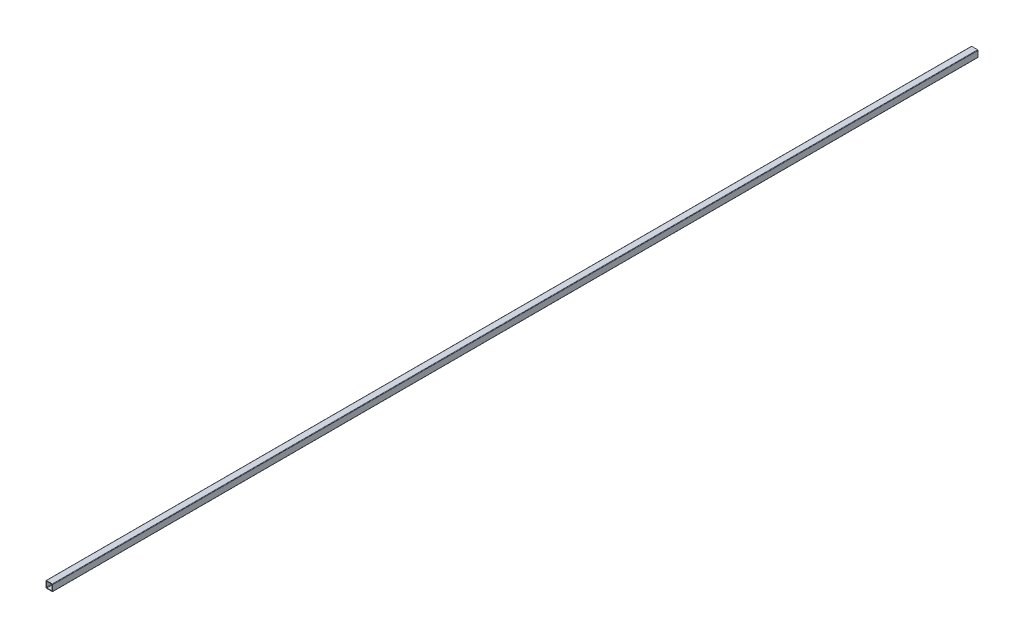
from build123d import *

# Parameters (mm, degrees)
BOSS_EXTRUDE1_DEPTH = 5243.80000006


with BuildPart() as part:
    # Sketch1 → Boss-Extrude1 (new body)
    with BuildSketch(Plane.XY):
        with BuildLine():
            Line((2.54, 0), (35.56, 0))
            ThreePointArc((35.56, 0), (37.356051224, -0.743948776), (38.1, -2.54))
            Line((38.1, -2.54), (38.1, -35.56))
            ThreePointArc((38.1, -35.56), (37.356051224, -37.356051224), (35.56, -38.1))
            Line((35.56, -38.1), (2.54, -38.1))
            ThreePointArc((2.54, -38.1), (0.743948776, -37.356051224), (0, -35.56))
            Line((0, -35.56), (0, -2.54))
            ThreePointArc((0, -2.54), (0.743948776, -0.743948776), (2.54, 0))
        make_face()
        with BuildLine():
            Line((5.3086, -2.7686), (32.7914, -2.7686))
            ThreePointArc((32.7914, -2.7686), (34.587451224, -3.512548776), (35.3314, -5.3086))
            Line((35.3314, -5.3086), (35.3314, -32.7914))
            ThreePointArc((35.3314, -32.7914), (34.587451224, -34.587451224), (32.7914, -35.3314))
            Line((32.7914, -35.3314), (5.3086, -35.3314))
            ThreePointArc((5.3086, -35.3314), (3.512548776, -34.587451224), (2.7686, -32.7914))
            Line((2.7686, -32.7914), (2.7686, -5.3086))
            ThreePointArc((2.7686, -5.3086), (3.512548776, -3.512548776), (5.3086, -2.7686))
        make_face(mode=Mode.SUBTRACT)
    extrude(amount=BOSS_EXTRUDE1_DEPTH)


solid = part.part
